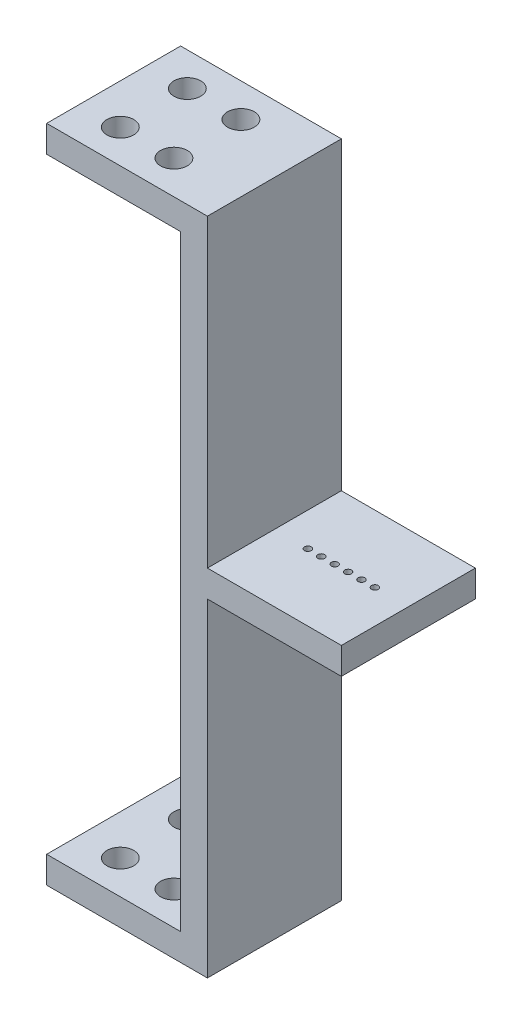
from build123d import *

# Parameters (mm, degrees)
BOSS_EXTRUDE1_DEPTH = 20
SKETCH2_R           = 2
CUT_EXTRUDE1_DEPTH  = 104.335618254
SKETCH4_R           = 0.5
CUT_EXTRUDE2_DEPTH  = 20


with BuildPart() as part:
    # Sketch1 → Boss-Extrude1 (new body)
    with BuildSketch(Plane.XY):
        Polygon((-24, 49.25), (0, 49.25), (0, 3.75), (20, 3.75), (20, -0.25), (0, -0.25), (0, -49.25), (-24, -49.25), (-24, -45.25), (-4, -45.25), (-4, 45.25), (-24, 45.25), align=None)
    extrude(amount=BOSS_EXTRUDE1_DEPTH)

    # Sketch2 → Cut-Extrude1 (cut, through all)
    with BuildSketch(Plane(origin=(0, 49.25, 0), x_dir=(1, 0, 0), z_dir=(0, 1, 0))):
        with Locations(Location((-18, -5, 0), (0, 0, 270))):
            Circle(SKETCH2_R)
        with Locations(Location((-10, -5, 0), (0, 0, 270))):
            Circle(SKETCH2_R)
        with Locations(Location((-10, -15, 0), (0, 0, 270))):
            Circle(SKETCH2_R)
        with Locations(Location((-18, -15, 0), (0, 0, 270))):
            Circle(SKETCH2_R)
    extrude(amount=-CUT_EXTRUDE1_DEPTH, mode=Mode.SUBTRACT)

    # Sketch4 → Cut-Extrude2 (cut)
    with BuildSketch(Plane(origin=(0, 3.75, 0), x_dir=(1, 0, 0), z_dir=(0, 1, 0))):
        with Locations(Location((15, -10, 0), (0, 0, 270))):
            Circle(SKETCH4_R)
        with Locations(Location((13, -10, 0), (0, 0, 270))):
            Circle(SKETCH4_R)
        with Locations(Location((11, -10, 0), (0, 0, 270))):
            Circle(SKETCH4_R)
        with Locations(Location((9, -10, 0), (0, 0, 270))):
            Circle(SKETCH4_R)
        with Locations(Location((7, -10, 0), (0, 0, 270))):
            Circle(SKETCH4_R)
        with Locations(Location((5, -10, 0), (0, 0, 270))):
            Circle(SKETCH4_R)
    extrude(amount=-CUT_EXTRUDE2_DEPTH, mode=Mode.SUBTRACT)


solid = part.part
